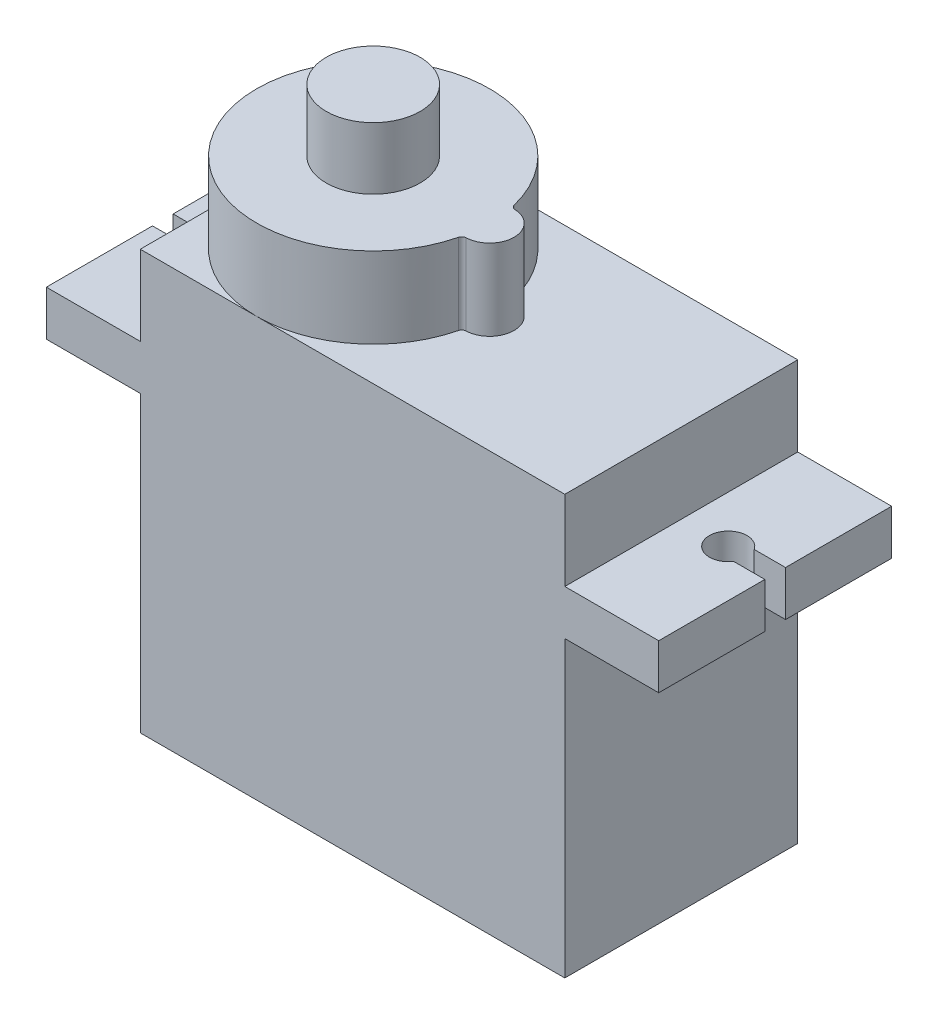
from build123d import *

# Parameters (mm, degrees)
SKETCH1_W             = 22.6
SKETCH1_H             = 12.4
BOSS_EXTRUDE1_DEPTH   = 22.3
SKETCH2_W             = 5
SKETCH2_H             = 2.4
BOSS_EXTRUDE2_DEPTH   = 12.4
CUT_EXTRUDE1_DEPTH    = 26.098456128
BOSS_EXTRUDE3_DEPTH   = 4.3
SKETCH5_R             = 2.5
BOSS_EXTRUDE4_DEPTH   = 3.3
SKETCH6_R             = 0.6
BOSS_EXTRUDE7_DEPTH   = 2.3
BOSS_EXTRUDE7_2_DEPTH = 2.3
BOSS_EXTRUDE7_3_DEPTH = 2.3


with BuildPart() as part:
    # Sketch1 → Boss-Extrude1 (new body)
    with BuildSketch(Plane(origin=(0, 0, 0), x_dir=(1, 0, 0), z_dir=(0, 1, 0))):
        Rectangle(SKETCH1_W, SKETCH1_H)
    extrude(amount=BOSS_EXTRUDE1_DEPTH)

    # Sketch2 → Boss-Extrude2 (add)
    with BuildSketch(Plane.XY.offset(6.2)):
        with Locations((13.8, 16.85)):
            Rectangle(SKETCH2_W, SKETCH2_H)
        with Locations((-13.8, 16.85)):
            Rectangle(SKETCH2_W, SKETCH2_H)
    extrude(amount=-BOSS_EXTRUDE2_DEPTH)

    # Sketch3 → Cut-Extrude1 (cut, through all)
    with BuildSketch(Plane(origin=(0, 18.05, 0), x_dir=(1, 0, 0), z_dir=(0, 1, 0))):
        with BuildLine():
            Line((14.635164654, 0.55), (16.3, 0.55))
            Line((16.3, 0.55), (16.3, -0.55))
            Line((16.3, -0.55), (14.635164654, -0.55))
            ThreePointArc((14.635164654, -0.55), (12.8, 0), (14.635164654, 0.55))
        make_face()
        with BuildLine():
            Line((-16.3, -0.55), (-14.635164654, -0.55))
            ThreePointArc((-14.635164654, -0.55), (-12.8, 0), (-14.635164654, 0.55))
            Line((-14.635164654, 0.55), (-16.3, 0.55))
            Line((-16.3, 0.55), (-16.3, -0.55))
        make_face()
    extrude(amount=-CUT_EXTRUDE1_DEPTH, mode=Mode.SUBTRACT)

    # Sketch4 → Boss-Extrude3 (add)
    with BuildSketch(Plane(origin=(0, 22.3, 0), x_dir=(1, 0, 0), z_dir=(0, 1, 0))):
        with BuildLine():
            ThreePointArc((0.918604651, 1.488757218), (-11.3, 0), (0.918604651, -1.488757218))
            ThreePointArc((0.918604651, -1.488757218), (1.003329596, -1.355013632), (1.151404787, -1.298983275))
            ThreePointArc((1.151404787, -1.298983275), (2.4, 0), (1.151404787, 1.298983275))
            ThreePointArc((1.151404787, 1.298983275), (1.003329596, 1.355013632), (0.918604651, 1.488757218))
        make_face()
    extrude(amount=BOSS_EXTRUDE3_DEPTH)

    # Sketch5 → Boss-Extrude4 (add)
    with BuildSketch(Plane(origin=(0, 26.6, 0), x_dir=(1, 0, 0), z_dir=(0, 1, 0))):
        with Locations(Location((-5.1, 0, 0), (0, 0, 270))):
            Circle(SKETCH5_R)
    extrude(amount=BOSS_EXTRUDE4_DEPTH)


with BuildPart() as body_2:
    # Sketch6 → Boss-Extrude7 (new body)
    with BuildSketch(Plane.ZY.offset(11.3)):
        with Locations((0, 4.5)):
            Circle(SKETCH6_R)
    extrude(amount=BOSS_EXTRUDE7_DEPTH)


with BuildPart() as body_3:
    # Sketch6 → Boss-Extrude7 2 (new body)
    with BuildSketch(Plane.ZY.offset(11.3)):
        with Locations((1.2, 4.5)):
            Circle(SKETCH6_R)
    extrude(amount=BOSS_EXTRUDE7_2_DEPTH)


with BuildPart() as body_4:
    # Sketch6 → Boss-Extrude7 3 (new body)
    with BuildSketch(Plane.ZY.offset(11.3)):
        with Locations((-1.2, 4.5)):
            Circle(SKETCH6_R)
    extrude(amount=BOSS_EXTRUDE7_3_DEPTH)


solid = Compound([part.part, body_2.part, body_3.part, body_4.part])
